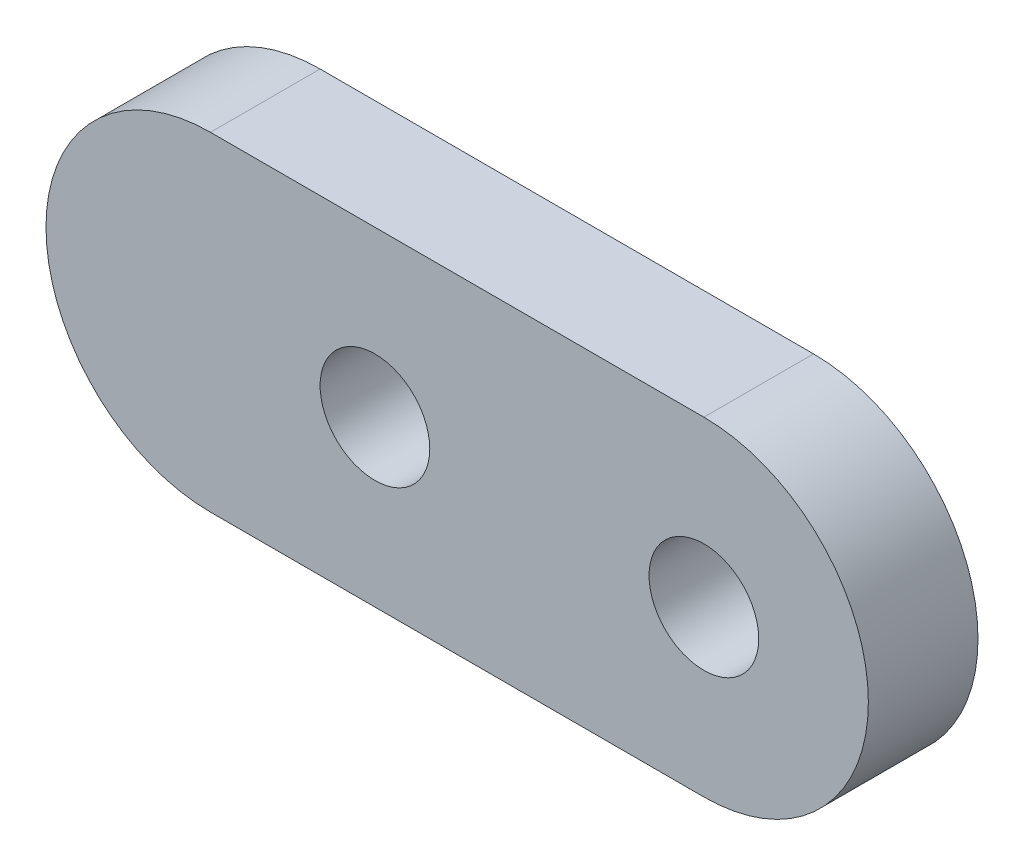
from build123d import *

# Parameters (mm, degrees)
MODEL_R                 = 1.5
SALIENTE_EXTRUIR1_DEPTH = 3


with BuildPart() as part:
    # Model → Saliente-Extruir1 (new body)
    with BuildSketch(Plane.XY):
        with BuildLine():
            Line((-1487.887905202, 378.53824964), (-1501.387905202, 378.53824964))
            ThreePointArc((-1501.387905202, 378.53824964), (-1505.887905202, 374.03824964), (-1501.387905202, 369.53824964))
            Line((-1501.387905202, 369.53824964), (-1487.887905202, 369.53824964))
            ThreePointArc((-1487.887905202, 369.53824964), (-1483.387905202, 374.03824964), (-1487.887905202, 378.53824964))
        make_face()
        with Locations((-1487.887905202, 374.03824964)):
            Circle(MODEL_R, mode=Mode.SUBTRACT)
        with Locations((-1496.887905202, 374.03824964)):
            Circle(MODEL_R, mode=Mode.SUBTRACT)
    extrude(amount=SALIENTE_EXTRUIR1_DEPTH)


solid = part.part
